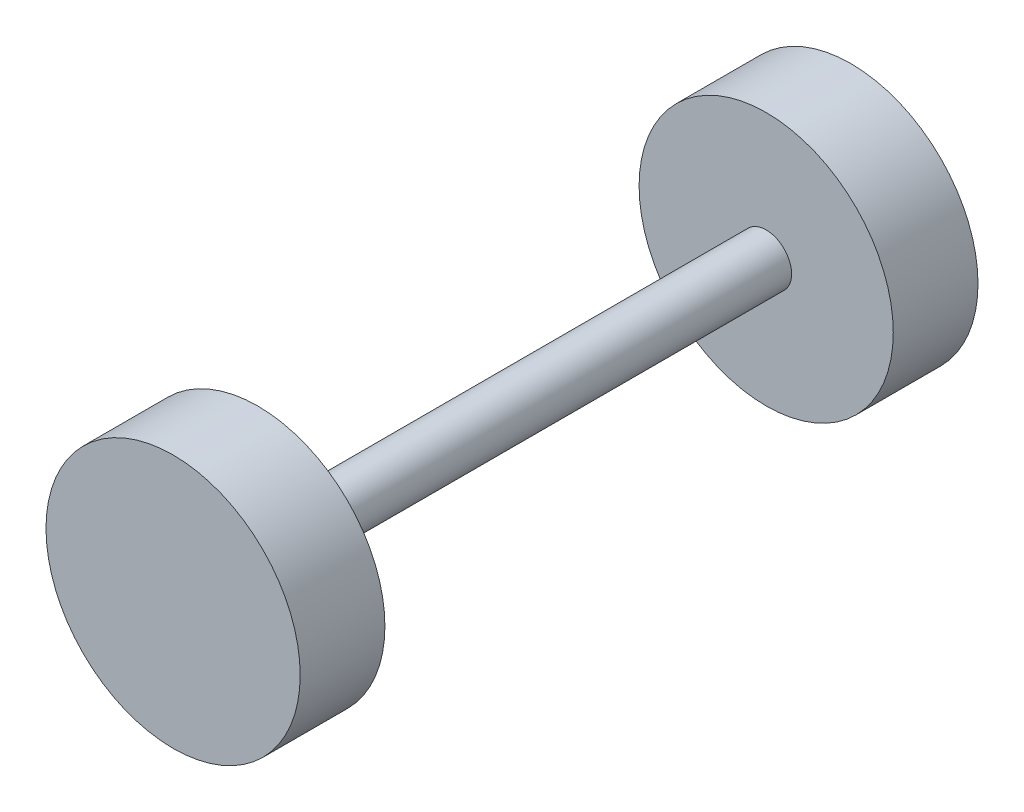
from build123d import *

# Parameters (mm, degrees)
ESQUISSE1_R        = 7.5
BOSS_EXTRU_1_DEPTH = 5
ESQUISSE2_R        = 1.5
BOSS_EXTRU_2_DEPTH = 30
ESQUISSE3_R        = 7.5
BOSS_EXTRU_3_DEPTH = 5


with BuildPart() as part:
    # Esquisse1 → Boss.-Extru.1 (new body)
    with BuildSketch(Plane.XY):
        Circle(ESQUISSE1_R)
    extrude(amount=BOSS_EXTRU_1_DEPTH)

    # Esquisse2 → Boss.-Extru.2 (add)
    with BuildSketch(Plane.XY.offset(5)):
        Circle(ESQUISSE2_R)
    extrude(amount=BOSS_EXTRU_2_DEPTH)

    # Esquisse3 → Boss.-Extru.3 (add)
    with BuildSketch(Plane.XY.offset(35)):
        Circle(ESQUISSE3_R)
    extrude(amount=BOSS_EXTRU_3_DEPTH)


solid = part.part
